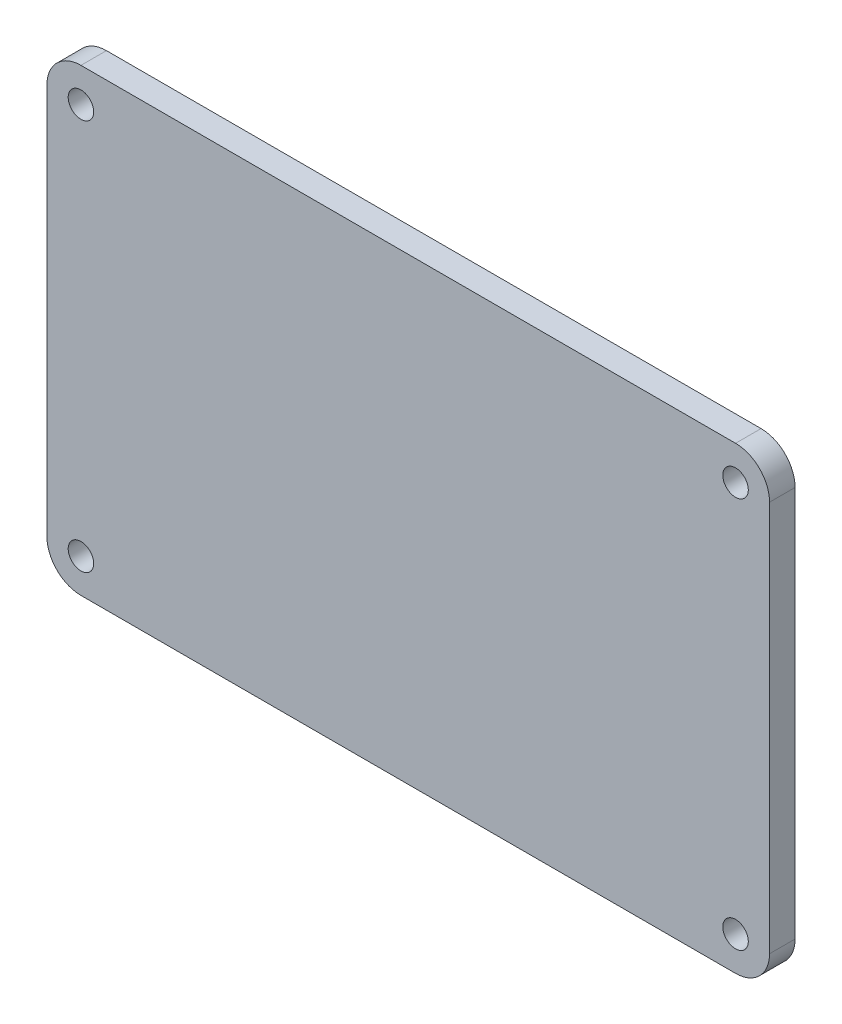
from build123d import *

# Parameters (mm, degrees)
ESQUISSE1_R        = 1.5
BOSS_EXTRU_1_DEPTH = 3


with BuildPart() as part:
    # Esquisse1 → Boss.-Extru.1 (new body)
    with BuildSketch(Plane(origin=(141.920138105, 723.12263115, -1989.578921243), x_dir=(1, 0, 0), z_dir=(0, 0, 1))):
        with BuildLine():
            Line((-35.130626261, 25.123386778), (41.869373739, 25.123386778))
            ThreePointArc((41.869373739, 25.123386778), (44.697800864, 23.951813903), (45.869373739, 21.123386778))
            Line((45.869373739, 21.123386778), (45.869373739, -24.876613222))
            ThreePointArc((45.869373739, -24.876613222), (44.697800864, -27.705040347), (41.869373739, -28.876613222))
            Line((41.869373739, -28.876613222), (-35.130626261, -28.876613222))
            ThreePointArc((-35.130626261, -28.876613222), (-37.959053386, -27.705040347), (-39.130626261, -24.876613222))
            Line((-39.130626261, -24.876613222), (-39.130626261, 21.123386778))
            ThreePointArc((-39.130626261, 21.123386778), (-37.959053386, 23.951813903), (-35.130626261, 25.123386778))
        make_face()
        with Locations((-35.130626261, -24.876613222)):
            Circle(ESQUISSE1_R, mode=Mode.SUBTRACT)
        with Locations((-35.130626261, 21.123386778)):
            Circle(ESQUISSE1_R, mode=Mode.SUBTRACT)
        with Locations((41.869373739, 21.123386778)):
            Circle(ESQUISSE1_R, mode=Mode.SUBTRACT)
        with Locations((41.869373739, -24.876613222)):
            Circle(ESQUISSE1_R, mode=Mode.SUBTRACT)
    extrude(amount=BOSS_EXTRU_1_DEPTH)


solid = part.part
